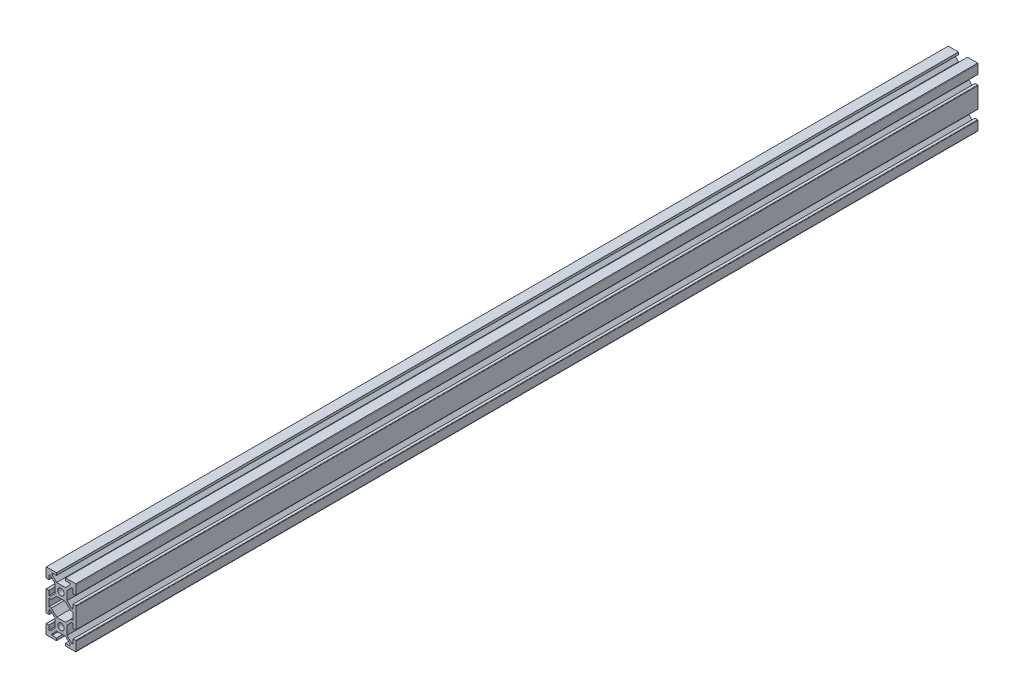
from build123d import *

# Parameters (mm, degrees)
SKETCH_1_R      = 2.1
EXTRUDE_1_DEPTH = 600


with BuildPart() as part:
    # 草图1 → 凸台-拉伸1 (new body)
    with BuildSketch(Plane.XY):
        with BuildLine():
            Line((-10, 19), (-10, 13.3))
            ThreePointArc((-10, 13.3), (-9.912132034, 13.087867966), (-9.7, 13))
            Line((-9.7, 13), (-8, 13))
            Line((-8, 13), (-8, 16))
            Line((-8, 16), (-7.060660172, 16))
            Line((-7.060660172, 16), (-4, 12.939339828))
            Line((-4, 12.939339828), (-4, 7.060660172))
            Line((-4, 7.060660172), (-7.060660172, 4))
            Line((-7.060660172, 4), (-8, 4))
            Line((-8, 4), (-8, 7))
            Line((-8, 7), (-9.7, 7))
            ThreePointArc((-9.7, 7), (-9.912132034, 6.912132034), (-10, 6.7))
            Line((-10, 6.7), (-10, -6.7))
            ThreePointArc((-10, -6.7), (-9.912132034, -6.912132034), (-9.7, -7))
            Line((-9.7, -7), (-8, -7))
            Line((-8, -7), (-8, -4))
            Line((-8, -4), (-7.060660172, -4))
            Line((-7.060660172, -4), (-4, -7.060660172))
            Line((-4, -7.060660172), (-4, -12.939339828))
            Line((-4, -12.939339828), (-7.060660172, -16))
            Line((-7.060660172, -16), (-8, -16))
            Line((-8, -16), (-8, -13))
            Line((-8, -13), (-9.7, -13))
            ThreePointArc((-9.7, -13), (-9.912132034, -13.087867966), (-10, -13.3))
            Line((-10, -13.3), (-10, -19))
            ThreePointArc((-10, -19), (-9.948683298, -19.316227766), (-9.8, -19.6))
            Line((-9.8, -19.6), (-3, -19.6))
            Line((-3, -19.6), (-3, -18))
            Line((-3, -18), (-6, -18))
            Line((-6, -18), (-6, -17.060660172))
            Line((-6, -17.060660172), (-2.939339828, -14))
            Line((-2.939339828, -14), (2.939339828, -14))
            Line((2.939339828, -14), (6, -17.060660172))
            Line((6, -17.060660172), (6, -18))
            Line((6, -18), (3, -18))
            Line((3, -18), (3, -19.6))
            Line((3, -19.6), (9.8, -19.6))
            ThreePointArc((9.8, -19.6), (9.948683298, -19.316227766), (10, -19))
            Line((10, -19), (10, -13.3))
            ThreePointArc((10, -13.3), (9.912132034, -13.087867966), (9.7, -13))
            Line((9.7, -13), (8, -13))
            Line((8, -13), (8, -16))
            Line((8, -16), (7.060660172, -16))
            Line((7.060660172, -16), (4, -12.939339828))
            Line((4, -12.939339828), (4, -7.060660172))
            Line((4, -7.060660172), (7.060660172, -4))
            Line((7.060660172, -4), (8, -4))
            Line((8, -4), (8, -7))
            Line((8, -7), (9.7, -7))
            ThreePointArc((9.7, -7), (9.912132034, -6.912132034), (10, -6.7))
            Line((10, -6.7), (10, 6.7))
            ThreePointArc((10, 6.7), (9.912132034, 6.912132034), (9.7, 7))
            Line((9.7, 7), (8, 7))
            Line((8, 7), (8, 4))
            Line((8, 4), (7.060660172, 4))
            Line((7.060660172, 4), (4, 7.060660172))
            Line((4, 7.060660172), (4, 12.939339828))
            Line((4, 12.939339828), (7.060660172, 16))
            Line((7.060660172, 16), (8, 16))
            Line((8, 16), (8, 13))
            Line((8, 13), (9.7, 13))
            ThreePointArc((9.7, 13), (9.912132034, 13.087867966), (10, 13.3))
            Line((10, 13.3), (10, 19))
            ThreePointArc((10, 19), (9.948683298, 19.316227766), (9.8, 19.6))
            Line((9.8, 19.6), (3, 19.6))
            Line((3, 19.6), (3, 18))
            Line((3, 18), (6, 18))
            Line((6, 18), (6, 17.060660172))
            Line((6, 17.060660172), (2.939339828, 14))
            Line((2.939339828, 14), (-2.939339828, 14))
            Line((-2.939339828, 14), (-6, 17.060660172))
            Line((-6, 17.060660172), (-6, 18))
            Line((-6, 18), (-3, 18))
            Line((-3, 18), (-3, 19.6))
            Line((-3, 19.6), (-9.8, 19.6))
            ThreePointArc((-9.8, 19.6), (-9.948683298, 19.316227766), (-10, 19))
        make_face()
        with Locations((0, -10)):
            Circle(SKETCH_1_R, mode=Mode.SUBTRACT)
        with Locations((0, 10)):
            Circle(SKETCH_1_R, mode=Mode.SUBTRACT)
        Polygon((-8, -2.5), (-6.439339828, -2.5), (-2.939339828, -6), (2.939339828, -6), (6.439339828, -2.5), (8, -2.5), (8, 2.5), (6.439339828, 2.5), (2.939339828, 6), (-2.939339828, 6), (-6.439339828, 2.5), (-8, 2.5), align=None, mode=Mode.SUBTRACT)
    extrude(amount=-EXTRUDE_1_DEPTH)


solid = part.part
